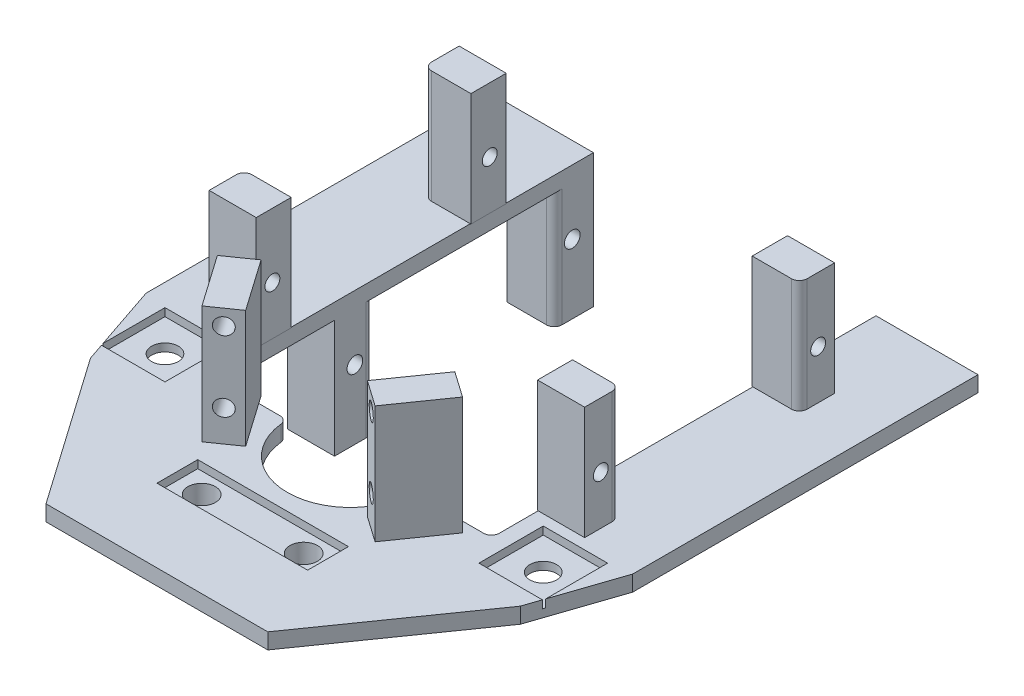
from build123d import *

# Parameters (mm, degrees)
EXTRUDE_1_DEPTH      = 2
CUT_EXTRUDE_1_DEPTH  = 2
SKETCH_3_W           = 3
SKETCH_3_H           = 3
EXTRUDE_2_DEPTH      = 12
EXTRUDE_3_DEPTH      = 15
SKETCH_5_R           = 0.75
CUT_EXTRUDE_2_DEPTH  = 12
SKETCH_6_R           = 1.05
CUT_EXTRUDE_3_DEPTH  = 12
SKETCH_7_W           = 26
SKETCH_7_H           = 60
EXTRUDE_4_DEPTH      = 2
SKETCH_8_W           = 6
SKETCH_8_H           = 4.457179677
SKETCH_8_H_2         = 4.5
EXTRUDE_5_DEPTH      = 14.4
SKETCH_9_R           = 0.95
CUT_EXTRUDE_4_DEPTH  = 14.4
SKETCH_10_W          = 26
SKETCH_10_H          = 8
EXTRUDE_6_DEPTH      = 2
SKETCH_11_W          = 4.5
SKETCH_11_H          = 4.5
EXTRUDE_7_DEPTH      = 14.4
SKETCH_12_R          = 0.95
CUT_EXTRUDE_5_DEPTH  = 14.4
SKETCH_13_W          = 4.5
SKETCH_13_H          = 4.5
CUT_EXTRUDE_6_DEPTH  = 14.4
SKETCH_15_R          = 1.75
CUT_EXTRUDE_8_DEPTH  = 12
SKETCH_14_W          = 3
SKETCH_14_H          = 3
CUT_EXTRUDE_9_DEPTH  = 12
CUT_EXTRUDE_11_DEPTH = 10
CUT_EXTRUDE_13_DEPTH = 5
SKETCH_22_W          = 8.2
SKETCH_22_H          = 8.2
CUT_EXTRUDE_15_DEPTH = 1
SKETCH_23_W          = 10
SKETCH_23_H          = 49
CUT_EXTRUDE_16_DEPTH = 10
FILLET_4_R           = 1
SKETCH_24_W          = 19.2
SKETCH_24_H          = 5.2
CUT_EXTRUDE_17_DEPTH = 1
EXTRUDE_START        = -1
SKETCH_25_W          = 21.2
SKETCH_25_H          = 7.2
SKETCH_25_R          = 1.75
EXTRUDE_10_DEPTH     = 2
FILLET_5_R           = 1
CUT_EXTRUDE_18_DEPTH = 10
CUT_EXTRUDE_19_DEPTH = 10
FILLET_7_R           = 1
EXTRUDE_12_DEPTH     = 6
SKETCH_34_R          = 1
CUT_EXTRUDE_24_DEPTH = 10
FILLET_9_R           = 1
SKETCH_31_W          = 28.262434414
SKETCH_31_H          = 5.377761842
CUT_EXTRUDE_22_DEPTH = 10
SKETCH_32_R          = 1.7
CUT_EXTRUDE_23_DEPTH = 10


with BuildPart() as part:
    # 草图1 → 凸台-拉伸1 (new body)
    with BuildSketch(Plane(origin=(0, 0, 0), x_dir=(1, 0, 0), z_dir=(0, 1, 0))):
        with BuildLine():
            Line((5, 0), (31, 0))
            Line((31, 0), (31, -12.266105287))
            Line((31, -12.266105287), (17.561663747, -40))
            Line((17.561663747, -40), (-17.561663747, -40))
            Line((-17.561663747, -40), (-31, -12.266105287))
            Line((-31, -12.266105287), (-31, 0))
            Line((-31, 0), (-5, 0))
            Line((-5, 0), (-5, -5))
            ThreePointArc((-5, -5), (0, -10), (5, -5))
            Line((5, -5), (5, 0))
        make_face()
    extrude(amount=EXTRUDE_1_DEPTH)

    # 草图2 → 切除-拉伸1 (cut)
    with BuildSketch(Plane.XZ):
        Polygon((-31, 0), (-24.370648345, 19.60824232), (-13.01326486, 35.515995577), (-4.410164775, 40), (-17.561663747, 40), (-31, 12.266105287), align=None)
    cut_extrude_1 = extrude(amount=-CUT_EXTRUDE_1_DEPTH, mode=Mode.SUBTRACT)

    # 镜向1: 切除-拉伸1 across plane
    add(cut_extrude_1.mirror(Plane(origin=(0, 0, 0), x_dir=(0, 0, 1), z_dir=(1, 0, 0))), mode=Mode.SUBTRACT)

    # 草图3 → 凸台-拉伸2 (add)
    with BuildSketch(Plane(origin=(0, 2, 0), x_dir=(1, 0, 0), z_dir=(0, 1, 0))):
        with Locations((0.264476572, -30.687696452)):
            Rectangle(SKETCH_3_W, SKETCH_3_H)
    extrude(amount=EXTRUDE_2_DEPTH)

    # 草图4 → 凸台-拉伸3 (add)
    with BuildSketch(Plane(origin=(0, 2, 0), x_dir=(1, 0, 0), z_dir=(0, 1, 0))):
        Polygon((12.4652939, -10.808762302), (14.186023209, -8.35130617), (15.6199643, -6.303426059), (12.343356123, -4.009120313), (10.909415032, -6.057000424), (9.188685723, -8.514456557), (7.754744632, -10.562336668), (11.031352809, -12.856642413), align=None)
    extrude_3 = extrude(amount=EXTRUDE_3_DEPTH)

    # 草图5 → 切除-拉伸2 (cut)
    with BuildSketch(Plane.ZY.offset(1.235523428)):
        with Locations((30.687696452, 11.5)):
            Circle(SKETCH_5_R)
        with Locations((30.687696452, 4.5)):
            Circle(SKETCH_5_R)
    extrude(amount=-CUT_EXTRUDE_2_DEPTH, mode=Mode.SUBTRACT)

    # 草图6 → 切除-拉伸3 (cut)
    with BuildSketch(Plane(origin=(25.938855932, 0, 23.294988476), x_dir=(0.8191520442889928, 0, 0.5735764363510446), z_dir=(-0.5735764363510446, 0, 0.8191520442889928))):
        with Locations((-20.198700994, 15)):
            Circle(SKETCH_6_R)
        with Locations((-20.198700994, 6)):
            Circle(SKETCH_6_R)
    cut_extrude_3 = extrude(amount=-CUT_EXTRUDE_3_DEPTH, mode=Mode.SUBTRACT)

    # 镜向2: 凸台-拉伸3, 切除-拉伸3 across plane
    add(extrude_3.mirror(Plane(origin=(0, 0, 0), x_dir=(0, 0, 1), z_dir=(1, 0, 0))))
    add(cut_extrude_3.mirror(Plane(origin=(0, 0, 0), x_dir=(0, 0, 1), z_dir=(1, 0, 0))), mode=Mode.SUBTRACT)

    # 草图7 → 凸台-拉伸4 (add)
    with BuildSketch(Plane(origin=(0, 2, 0), x_dir=(1, 0, 0), z_dir=(0, 1, 0))):
        with Locations((-18, 30)):
            Rectangle(SKETCH_7_W, SKETCH_7_H)
        with Locations((18, 30)):
            Rectangle(SKETCH_7_W, SKETCH_7_H)
    extrude(amount=-EXTRUDE_4_DEPTH)

    # 草图8 → 凸台-拉伸5 (add)
    with BuildSketch(Plane(origin=(0, 2, 0), x_dir=(1, 0, 0), z_dir=(0, 1, 0))):
        with Locations((20.92336727, 3.180021452)):
            Rectangle(SKETCH_8_W, SKETCH_8_H)
        with Locations((20.92336727, 30.55861129)):
            Rectangle(SKETCH_8_W, SKETCH_8_H_2)
    extrude_5 = extrude(amount=EXTRUDE_5_DEPTH)

    # 草图9 → 切除-拉伸4 (cut)
    with BuildSketch(Plane(origin=(31, 0, 0), x_dir=(0, 0, -1), z_dir=(1, 0, 0))):
        with Locations((3.00861129, 8.2)):
            Circle(SKETCH_9_R)
        with Locations((30.70861129, 8.2)):
            Circle(SKETCH_9_R)
    cut_extrude_4 = extrude(amount=-CUT_EXTRUDE_4_DEPTH, mode=Mode.SUBTRACT)

    # 镜向3: 凸台-拉伸5, 切除-拉伸4 across plane
    add(extrude_5.mirror(Plane(origin=(0, 0, 0), x_dir=(0, 0, 1), z_dir=(1, 0, 0))))
    add(cut_extrude_4.mirror(Plane(origin=(0, 0, 0), x_dir=(0, 0, 1), z_dir=(1, 0, 0))), mode=Mode.SUBTRACT)

    # 草图10 → 凸台-拉伸6 (add)
    with BuildSketch(Plane(origin=(0, 2, 0), x_dir=(1, 0, 0), z_dir=(0, 1, 0))):
        with Locations((-18, 64)):
            Rectangle(SKETCH_10_W, SKETCH_10_H)
        Polygon((5, 60), (5, 68), (30.798641436, 68), (31, 60), align=None)
    extrude(amount=-EXTRUDE_6_DEPTH)

    # 草图11 → 凸台-拉伸7 (add)
    with BuildSketch(Plane(origin=(0, 2, 0), x_dir=(1, 0, 0), z_dir=(0, 1, 0))):
        with Locations((18.529999999, 37.05861129)):
            Rectangle(SKETCH_11_W, SKETCH_11_H)
        with Locations((18.529999999, 64.45861129)):
            Rectangle(SKETCH_11_W, SKETCH_11_H)
    extrude(amount=EXTRUDE_7_DEPTH)

    # 草图12 → 切除-拉伸5 (cut)
    with BuildSketch(Plane.ZY.offset(-16.279999999)):
        with Locations((-36.90861129, 8.2)):
            Circle(SKETCH_12_R)
        with Locations((-64.60861129, 8.2)):
            Circle(SKETCH_12_R)
    extrude(amount=-CUT_EXTRUDE_5_DEPTH, mode=Mode.SUBTRACT)

    # 草图13 → 切除-拉伸6 (cut)
    with BuildSketch(Plane(origin=(0, 16.4, 0), x_dir=(1, 0, 0), z_dir=(0, 1, 0))):
        with Locations((18.529999999, 37.05861129)):
            Rectangle(SKETCH_13_W, SKETCH_13_H)
        with Locations((18.529999999, 64.45861129)):
            Rectangle(SKETCH_13_W, SKETCH_13_H)
    extrude(amount=-CUT_EXTRUDE_6_DEPTH, mode=Mode.SUBTRACT)

    # 草图15 → 切除-拉伸8 (cut)
    with BuildSketch(Plane(origin=(0, 2, 0), x_dir=(1, 0, 0), z_dir=(0, 1, 0))):
        with Locations(Location((-6.235523428, -17.687696452, 0), (0, 0, 270))):
            Circle(SKETCH_15_R)
        with Locations(Location((6.764476572, -17.687696452, 0), (0, 0, 270))):
            Circle(SKETCH_15_R)
    extrude(amount=-CUT_EXTRUDE_8_DEPTH, mode=Mode.SUBTRACT)

    # 草图14 → 切除-拉伸9 (cut)
    with BuildSketch(Plane(origin=(0, 14, 0), x_dir=(1, 0, 0), z_dir=(0, 1, 0))):
        with Locations((0.264476572, -30.687696452)):
            Rectangle(SKETCH_14_W, SKETCH_14_H)
    extrude(amount=-CUT_EXTRUDE_9_DEPTH, mode=Mode.SUBTRACT)

    # 草图17 → 切除-拉伸11 (cut)
    with BuildSketch(Plane.XZ):
        Polygon((-20.533375452, -44), (-31, -44), (-37, -44), (-37, -68), (-31, -68), (30.798641436, -68), (38, -68), (38, -44), (31, -44), align=None)
    extrude(amount=-CUT_EXTRUDE_11_DEPTH, mode=Mode.SUBTRACT)

    # 草图20 → 切除-拉伸13 (cut, symmetric)
    with BuildSketch(Plane.XZ):
        with BuildLine():
            Line((5, -44), (8, -44))
            Line((8, -44), (8, 5))
            ThreePointArc((8, 5), (0, 13), (-8, 5))
            Line((-8, 5), (-8, -44))
            Line((-8, -44), (5, -44))
        make_face()
    extrude(amount=CUT_EXTRUDE_13_DEPTH, both=True, mode=Mode.SUBTRACT)

    # 草图22 → 切除-拉伸15 (cut)
    with BuildSketch(Plane(origin=(0, 2, 0), x_dir=(1, 0, 0), z_dir=(0, 1, 0))):
        with Locations((24.1, -4.499009955)):
            Rectangle(SKETCH_22_W, SKETCH_22_H)
        with Locations((-24.1, -4.499009955)):
            Rectangle(SKETCH_22_W, SKETCH_22_H)
    extrude(amount=-CUT_EXTRUDE_15_DEPTH, mode=Mode.SUBTRACT)

    # 草图23 → 切除-拉伸16 (cut)
    with BuildSketch(Plane(origin=(0, 2, 0), x_dir=(1, 0, 0), z_dir=(0, 1, 0))):
        with Locations((13, 19.5)):
            Rectangle(SKETCH_23_W, SKETCH_23_H)
    cut_extrude_16 = extrude(amount=-CUT_EXTRUDE_16_DEPTH, mode=Mode.SUBTRACT)

    # 镜向6: 切除-拉伸16 across plane
    add(cut_extrude_16.mirror(Plane(origin=(0, 0, 0), x_dir=(0, 0, 1), z_dir=(1, 0, 0))), mode=Mode.SUBTRACT)

    # 圆角4
    fillet_4_edges = [part.edges().sort_by_distance(p)[0] for p in [
        (-8, 1, 5),
        (8, 1, 5),
        (18, 1, 5),
        (-18, 1, 5),
    ]]
    fillet(fillet_4_edges, radius=FILLET_4_R)

    # 草图24 → 切除-拉伸17 (cut)
    with BuildSketch(Plane(origin=(0, 2, 0), x_dir=(1, 0, 0), z_dir=(0, 1, 0))):
        with Locations((0.264476572, -17.687625884)):
            Rectangle(SKETCH_24_W, SKETCH_24_H)
    extrude(amount=-CUT_EXTRUDE_17_DEPTH, mode=Mode.SUBTRACT)

    # 草图25 → 凸台-拉伸10 (add)
    with BuildSketch(Plane(origin=(0, 1, 0), x_dir=(1, 0, 0), z_dir=(0, 1, 0)).offset(EXTRUDE_START)):
        with Locations((0.264476572, -17.687625884)):
            Rectangle(SKETCH_25_W, SKETCH_25_H)
        with Locations(Location((-6.235523428, -17.687696452, 0), (0, 0, 270))):
            Circle(SKETCH_25_R, mode=Mode.SUBTRACT)
        with Locations(Location((6.764476572, -17.687696452, 0), (0, 0, 270))):
            Circle(SKETCH_25_R, mode=Mode.SUBTRACT)
    extrude(amount=-EXTRUDE_10_DEPTH)

    # 圆角5
    fillet_5_edges = [part.edges().sort_by_distance(p)[0] for p in [
        (10.864476572, -1, 14.087625884),
        (10.864476572, -1, 21.287625884),
        (-10.335523428, -1, 21.287625884),
        (-10.335523428, -1, 14.087625884),
    ]]
    fillet(fillet_5_edges, radius=FILLET_5_R)

    # 草图26 → 切除-拉伸18 (cut)
    with BuildSketch(Plane(origin=(0, 2, 0), x_dir=(1, 0, 0), z_dir=(0, 1, 0))):
        with BuildLine():
            Line((-35.006467671, 0), (-35.006467671, -42.039018824))
            Line((-35.006467671, -42.039018824), (35.006467671, -42.039018824))
            Line((35.006467671, -42.039018824), (35.006467671, 0))
            ThreePointArc((35.006467671, 0), (0, -35.006467671), (-35.006467671, 0))
        make_face()
    extrude(amount=-CUT_EXTRUDE_18_DEPTH, mode=Mode.SUBTRACT)

    # 草图27 → 切除-拉伸19 (cut)
    with BuildSketch(Plane(origin=(0, 2, 0), x_dir=(1, 0, 0), z_dir=(0, 1, 0))):
        Polygon((-27.379819186, -10.707741319), (-14.131217207, -29.628705829), (-14.131217207, -32.027511284), (-27.379819186, -32.027511284), align=None)
    cut_extrude_19 = extrude(amount=-CUT_EXTRUDE_19_DEPTH, mode=Mode.SUBTRACT)

    # 镜向4: 切除-拉伸19 across plane
    add(cut_extrude_19.mirror(Plane(origin=(0, 0, 0), x_dir=(0, 0, 1), z_dir=(1, 0, 0))), mode=Mode.SUBTRACT)

    # 圆角7
    fillet_7_edges = [part.edges().sort_by_distance(p)[0] for p in [
        (23.92336727, 9.2, -5.40861129),
        (23.92336727, 9.2, -28.30861129),
        (-23.92336727, 9.2, -5.40861129),
        (-23.92336727, 9.2, -28.30861129),
    ]]
    fillet(fillet_7_edges, radius=FILLET_7_R)

    # 草图33 → 凸台-拉伸12 (add)
    with BuildSketch(Plane.ZY.offset(24)):
        Polygon((-44, 0), (-44, -15), (-39, -15), (-39, 0), (-39, 2), (-44, 2), align=None)
        Polygon((-16, 0), (-16, -15), (-11, -15), (-11, 0), (-11, 2), (-16, 2), align=None)
    extrude(amount=-EXTRUDE_12_DEPTH)

    # 草图34 → 切除-拉伸24 (cut)
    with BuildSketch(Plane(origin=(-18, 0, 0), x_dir=(0, 0, -1), z_dir=(1, 0, 0))):
        with Locations((13.6, -6.2)):
            Circle(SKETCH_34_R)
        with Locations((41.3, -6.2)):
            Circle(SKETCH_34_R)
    extrude(amount=-CUT_EXTRUDE_24_DEPTH, mode=Mode.SUBTRACT)

    # 圆角9
    fillet_9_edges = [part.edges().sort_by_distance(p)[0] for p in [
        (-18, -7.5, -39),
        (-18, -7.5, -16),
    ]]
    fillet(fillet_9_edges, radius=FILLET_9_R)

    # 草图31 → 切除-拉伸22 (cut)
    with BuildSketch(Plane(origin=(0, 2, 0), x_dir=(1, 0, 0), z_dir=(0, 1, 0))):
        with Locations((0, -32.31758675)):
            Rectangle(SKETCH_31_W, SKETCH_31_H)
    extrude(amount=-CUT_EXTRUDE_22_DEPTH, mode=Mode.SUBTRACT)

    # 草图32 → 切除-拉伸23 (cut)
    with BuildSketch(Plane(origin=(0, 1, 0), x_dir=(1, 0, 0), z_dir=(0, 1, 0))):
        with Locations(Location((-24.1, -4.499009955, 0), (0, 0, 270))):
            Circle(SKETCH_32_R)
        with Locations(Location((24.1, -4.499009955, 0), (0, 0, 270))):
            Circle(SKETCH_32_R)
    extrude(amount=-CUT_EXTRUDE_23_DEPTH, mode=Mode.SUBTRACT)


solid = part.part
